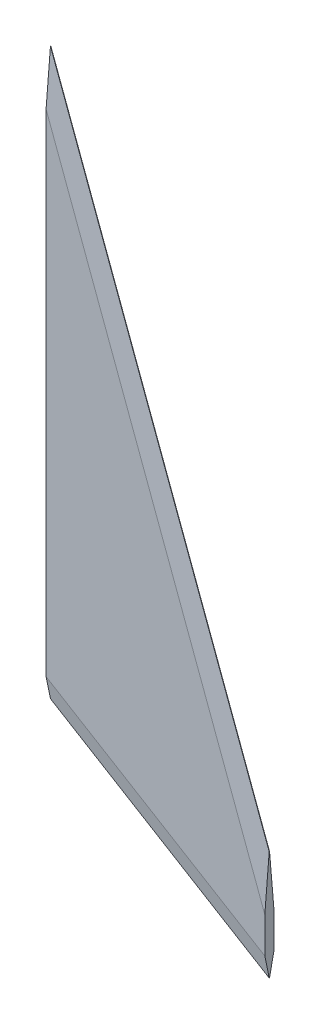
from build123d import *
from OCP.BRepFilletAPI import BRepFilletAPI_MakeChamfer

# Parameters (mm, degrees)
BOSS_EXTRUDE1_DEPTH = 6.35
CHAMFER1_SIZE       = 12.7
CHAMFER1_SIZE2      = 3.048
CHAMFER2_SIZE       = 3.048
CHAMFER2_SIZE2      = 12.7


with BuildPart() as part:
    # Sketch2 → Boss-Extrude1 (new body)
    with BuildSketch(Plane.XY):
        Polygon((0, 0), (0, 393.7), (152.414038874, -16.129), (152.414038874, -92.329), align=None)
    extrude(amount=BOSS_EXTRUDE1_DEPTH)

    # Chamfer1
    chamfer1_edges = [part.edges().sort_by_distance(p)[0] for p in [
        (76.207019437, 188.7855, 0),
        (76.207019437, -46.1645, 0),
    ]]
    chamfer1_side = [part.faces().sort_by_distance(p)[0] for p in [
        (59.04327632, 99.585162162, 0),
    ]]
    chamfer(chamfer1_edges, length=CHAMFER1_SIZE, length2=CHAMFER1_SIZE2, reference=chamfer1_side[0])

    # Chamfer2: one chamfer whose edges measure the first distance from different faces: ONE call of the kernel's chamfer builder (chamfer() names one face for all edges)
    chamfer2_edges_1 = [part.edges().sort_by_distance(p)[0] for p in [
        (76.207019437, 188.7855, 6.35),
    ]]
    chamfer2_side_1 = [part.faces().sort_by_distance(p)[0] for p in [
        (76.207019437, 188.7855, 4.699),
    ]]
    chamfer2_edges_2 = [part.edges().sort_by_distance(p)[0] for p in [
        (76.207019437, -46.1645, 6.35),
    ]]
    chamfer2_side_2 = [part.faces().sort_by_distance(p)[0] for p in [
        (76.207019437, -46.1645, 4.699),
    ]]
    chamfer2 = BRepFilletAPI_MakeChamfer(part.part.solid().wrapped)
    for e in chamfer2_edges_1:
        chamfer2.Add(CHAMFER2_SIZE, CHAMFER2_SIZE2, e.wrapped, chamfer2_side_1[0].wrapped)  # the first distance lies on this face
    for e in chamfer2_edges_2:
        chamfer2.Add(CHAMFER2_SIZE, CHAMFER2_SIZE2, e.wrapped, chamfer2_side_2[0].wrapped)  # the first distance lies on this face
    add(Compound.cast(chamfer2.Shape()), mode=Mode.REPLACE)


solid = part.part
